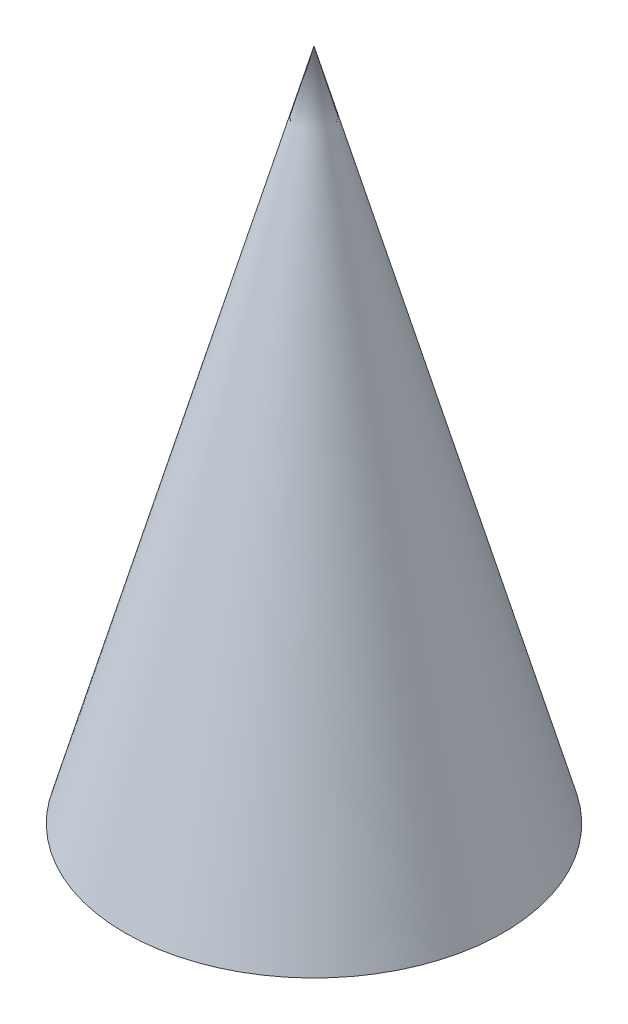
from build123d import *

# Parameters (mm, degrees)
SKETCH2_R          = 2.5
CUT_EXTRUDE1_DEPTH = 20


with BuildPart() as part:
    # Sketch1 → Revolve1 (revolve)
    with BuildSketch(Plane.XY, mode=Mode.PRIVATE) as revolve1_sk:
        Polygon((0, 325.102863253), (0, 271.755588021), (15, 271.755588021), align=None)
    revolve(revolve1_sk.sketch.rotate(Axis((0, 0, 0), (0, 1, 0)), 90), axis=Axis((0, 0, 0), (0, 1, 0)))

    # Sketch2 → Cut-Extrude1 (cut)
    with BuildSketch(Plane.XZ.offset(-271.755588021)):
        with Locations(Location((0, 0, 0), (0, 0, 270))):
            Circle(SKETCH2_R)
    extrude(amount=-CUT_EXTRUDE1_DEPTH, mode=Mode.SUBTRACT)

    # Sketch4 → Cut-Revolve1 (revolve, cut)
    with BuildSketch(Plane.XY, mode=Mode.PRIVATE) as cut_revolve1_sk:
        Polygon((15, 271.755588021), (0, 325.102863253), (0, 321.408464024), (13.961221764, 271.755588021), align=None)
    revolve(cut_revolve1_sk.sketch.rotate(Axis((0, 271.755588021, 0), (0, 1, 0)), 90), axis=Axis((0, 271.755588021, 0), (0, 1, 0)), mode=Mode.SUBTRACT)


solid = part.part
